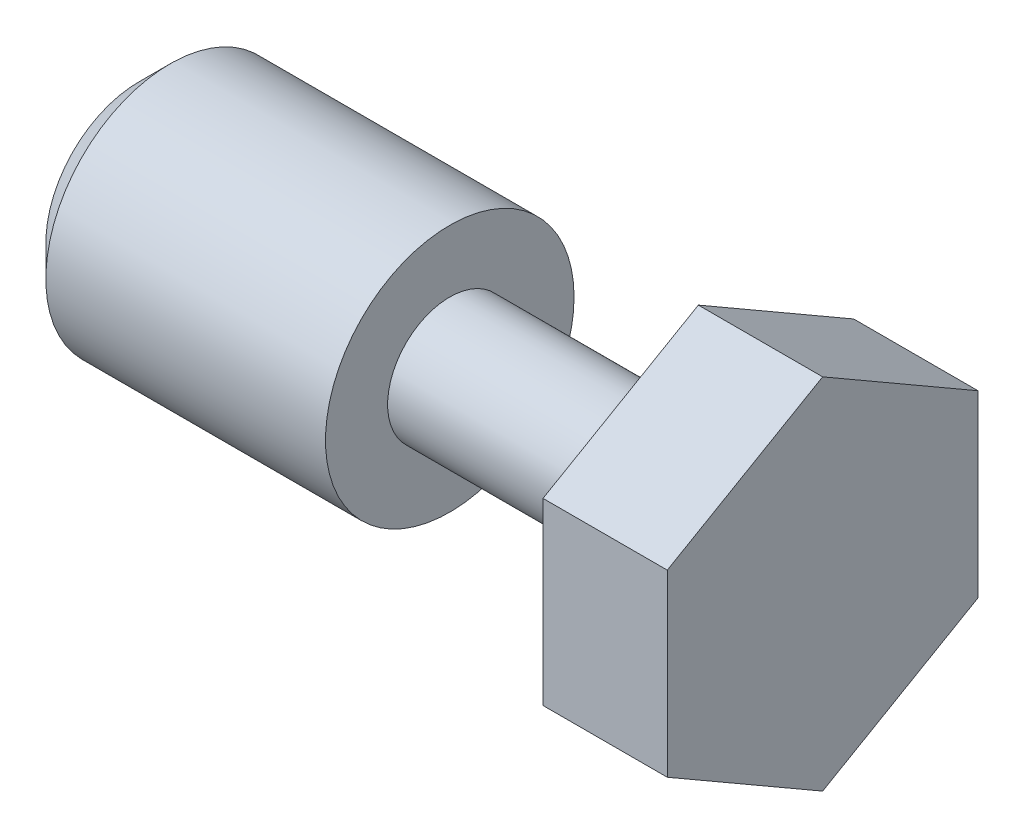
from build123d import *

# Parameters (mm, degrees)
SKETCH1_R           = 2
BOSS_EXTRUDE1_DEPTH = 5
SKETCH3_R           = 1
BOSS_EXTRUDE2_DEPTH = 4
BOSS_EXTRUDE3_DEPTH = 2
CHAMFER1_SIZE       = 0.5


with BuildPart() as part:
    # Sketch1 → Boss-Extrude1 (new body)
    with BuildSketch(Plane(origin=(0, 0, 0), x_dir=(0, 0, -1), z_dir=(1, 0, 0))):
        Circle(SKETCH1_R)
    extrude(amount=BOSS_EXTRUDE1_DEPTH)

    # Sketch3 → Boss-Extrude2 (add)
    with BuildSketch(Plane(origin=(5, 0, 0), x_dir=(0, 0, -1), z_dir=(1, 0, 0))):
        Circle(SKETCH3_R)
    extrude(amount=BOSS_EXTRUDE2_DEPTH)

    # Sketch4 → Boss-Extrude3 (add)
    with BuildSketch(Plane(origin=(9, 0, 0), x_dir=(0, 0, -1), z_dir=(1, 0, 0))):
        Polygon((0, -2.886751346), (2.5, -1.443375673), (2.5, 1.443375673), (0, 2.886751346), (-2.5, 1.443375673), (-2.5, -1.443375673), align=None)
    extrude(amount=BOSS_EXTRUDE3_DEPTH)

    # Chamfer1
    chamfer1_edges = [part.edges().sort_by_distance(p)[0] for p in [
        (0, 0, 2),
    ]]
    chamfer(chamfer1_edges, length=CHAMFER1_SIZE)


solid = part.part
